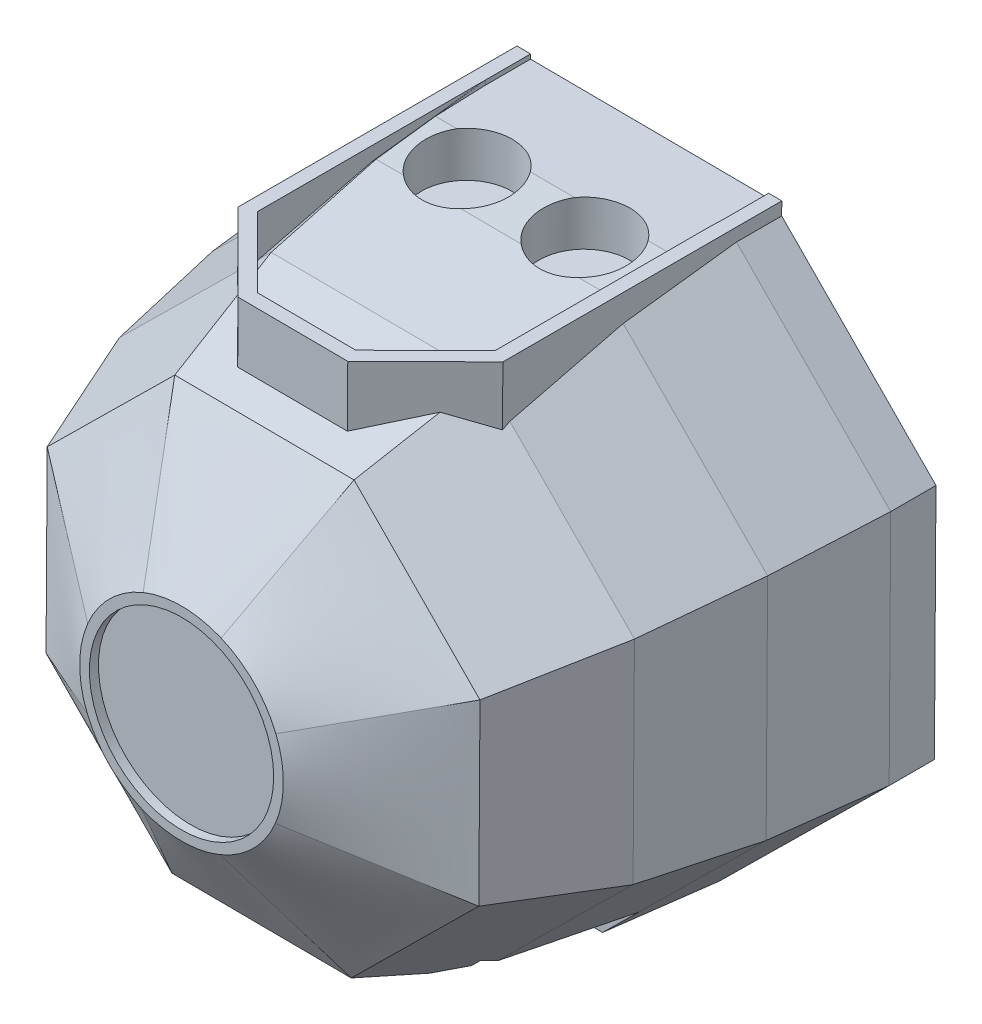
from build123d import *

# Parameters (mm, degrees)
RESSALTO_EXTRUS_O1_DEPTH  = 10
RESSALTO_EXTRUS_O2_DEPTH  = 25
RESSALTO_EXTRUS_O2_TAPER  = 5
RESSALTO_EXTRUS_O3_DEPTH  = 25
RESSALTO_EXTRUS_O3_TAPER  = 10
RESSALTO_EXTRUS_O4_DEPTH  = 25
RESSALTO_EXTRUS_O4_TAPER  = 20
ESBO_O8_R                 = 5
RESSALTO_EXTRUS_O6_DEPTH  = 18
CORTE_EXTRUS_O2_DEPTH     = 2
RESSALTO_EXTRUS_O10_DEPTH = 50
CORTE_EXTRUS_O5_START     = 35
CORTE_EXTRUS_O5_DEPTH     = 50
CORTE_EXTRUS_O6_DEPTH     = 20
CORTE_EXTRUS_O7_DEPTH     = 1
ESBO_O17_R                = 10
CORTE_EXTRUS_O8_DEPTH     = 10


with BuildPart() as part:
    # Esboço1 → Ressalto-extrusão1 (new body)
    with BuildSketch(Plane.XY):
        Polygon((11.714282715, 142.58825066), (-25.240942572, 180.026335933), (-77.844956945, 180.367769505), (-115.283042218, 143.412544218), (-115.624475789, 90.808529845), (-78.669250503, 53.370444572), (-26.06523613, 53.029011), (11.372849143, 89.984236287), align=None)
    extrude(amount=RESSALTO_EXTRUS_O1_DEPTH)

    # Esboço3 → Ressalto-extrusão2 (add)
    with BuildSketch(Plane.XY.offset(10)):
        Polygon((11.372849143, 89.984236287), (11.714282715, 142.58825066), (-25.240942572, 180.026335933), (-77.844956945, 180.367769505), (-115.283042218, 143.412544218), (-115.624475789, 90.808529845), (-78.669250503, 53.370444572), (-26.06523613, 53.029011), align=None)
    extrude(amount=RESSALTO_EXTRUS_O2_DEPTH, taper=RESSALTO_EXTRUS_O2_TAPER)

    # Esboço4 → Ressalto-extrusão3 (add)
    with BuildSketch(Plane.XY.offset(35)):
        Polygon((-26.956995692, 55.222061748), (9.191558856, 90.904388109), (9.521231967, 141.696491098), (-26.161094394, 177.845045645), (-76.953197383, 178.174718757), (-113.10175193, 142.492392396), (-113.431425042, 91.700289407), (-77.749098681, 55.55173486), align=None)
    extrude(amount=RESSALTO_EXTRUS_O3_DEPTH, taper=RESSALTO_EXTRUS_O3_TAPER)

    # Esboço5 → Ressalto-extrusão4 (add)
    with BuildSketch(Plane.XY.offset(60)):
        Polygon((-75.894600212, 59.947965354), (-28.754271643, 59.641994585), (4.795328361, 92.758886578), (5.10129913, 139.899215147), (-28.015592863, 173.448815151), (-75.155921432, 173.75478592), (-108.705521436, 140.637893927), (-109.011492205, 93.497565358), align=None)
    extrude(amount=RESSALTO_EXTRUS_O4_DEPTH, taper=RESSALTO_EXTRUS_O4_TAPER)

    # Esboço8 → Ressalto-extrusão6 (add)
    with BuildSketch(Plane.XY.offset(85)):
        with Locations((-51.955096537, 116.698390253)):
            Circle(ESBO_O8_R)
    extrude(amount=RESSALTO_EXTRUS_O6_DEPTH)

    # Esboço6 → Loft1 section 0
    with BuildSketch(Plane.XY.offset(85)):
        with BuildLine():
            Line((-99.887965086, 97.207462428), (-72.066585693, 69.022566624))
            Line((-72.066585693, 69.022566624), (-32.464168713, 68.765521704))
            Line((-32.464168713, 68.765521704), (-4.279272909, 96.586901097))
            Line((-4.279272909, 96.586901097), (-4.022227989, 136.189318077))
            Line((-4.022227989, 136.189318077), (-31.843607381, 164.374213881))
            Line((-31.843607381, 164.374213881), (-71.446024362, 164.631258801))
            Line((-71.446024362, 164.631258801), (-99.630920166, 136.809879409))
            Line((-99.630920166, 136.809879409), (-99.887965086, 97.207462428))
        make_face()
    # Esboço7 for Loft1 → Loft1 section 1
    with BuildSketch(Plane.XY.offset(103)):
        with BuildLine():
            # circular arc as an exact rational Bezier (weights 1, cos(half-angle), 1)
            Bezier((-72.797833823, 108.223114301), (-69.28725958, 99.58976984), (-60.700212313, 95.967424282), weights=[1, 0.923879532, 1])
            Bezier((-60.700212313, 95.967424282), (-52.113165047, 92.345078724), (-43.479820586, 95.855652967), weights=[1, 0.923879533, 1])
            Bezier((-43.479820586, 95.855652967), (-34.846476125, 99.36622721), (-31.224130567, 107.953274477), weights=[1, 0.923879532, 1])
            Bezier((-31.224130567, 107.953274477), (-27.601785009, 116.540321743), (-31.112359252, 125.173666204), weights=[1, 0.923879533, 1])
            Bezier((-31.112359252, 125.173666204), (-34.622933495, 133.807010665), (-43.209980762, 137.429356223), weights=[1, 0.923879532, 1])
            Bezier((-43.209980762, 137.429356223), (-51.797028028, 141.051701781), (-60.430372489, 137.541127538), weights=[1, 0.923879533, 1])
            Bezier((-60.430372489, 137.541127538), (-69.06371695, 134.030553295), (-72.686062508, 125.443506028), weights=[1, 0.923879532, 1])
            Bezier((-72.686062508, 125.443506028), (-76.308408066, 116.856458762), (-72.797833823, 108.223114301), weights=[1, 0.923879533, 1])
        make_face()
    loft()

    # Esboço9 → Corte-extrusão2 (cut)
    with BuildSketch(Plane.XY.offset(103)):
        with BuildLine():
            ThreePointArc((-44.042402012, 135.456037969), (-51.822961029, 137.056254156), (-59.62363648, 135.557170109))
            ThreePointArc((-59.62363648, 135.557170109), (-66.25684624, 131.187007783), (-70.712744254, 124.611084778))
            ThreePointArc((-70.712744254, 124.611084778), (-72.312960441, 116.830525761), (-70.813876394, 109.02985031))
            ThreePointArc((-70.813876394, 109.02985031), (-66.443714068, 102.39664055), (-59.867791063, 97.940742536))
            ThreePointArc((-59.867791063, 97.940742536), (-52.087232046, 96.340526349), (-44.286556595, 97.839610396))
            ThreePointArc((-44.286556595, 97.839610396), (-37.653346835, 102.209772722), (-33.197448821, 108.785695727))
            ThreePointArc((-33.197448821, 108.785695727), (-31.597232634, 116.566254744), (-33.096316681, 124.366930195))
            ThreePointArc((-33.096316681, 124.366930195), (-37.466479007, 131.000139955), (-44.042402012, 135.456037969))
        make_face()
    extrude(amount=-CORTE_EXTRUS_O2_DEPTH, mode=Mode.SUBTRACT)

    # Esboço13 → Corte-extrusão5 (cut)
    with BuildSketch(Plane.XY.offset(CORTE_EXTRUS_O5_START)):
        Polygon((-98.070713952, 55.683635091), (-5.651465, 55.083775278), (-7.425428207, 63.095457942), (-96.192902738, 63.671615412), align=None)
    extrude(amount=CORTE_EXTRUS_O5_DEPTH, mode=Mode.SUBTRACT)

    # Esboço15 → Corte-extrusão6 (cut)
    with BuildSketch(Plane(origin=(0.409199665, 63.044606215, 0), x_dir=(0.9999789364800716, -0.006490500457210974, 0), z_dir=(-0.006490500457210974, -0.9999789364800716, 0))):
        Polygon((-79.311433136, 61.3), (-60.111433136, 61.3), (-60.111433136, 63.8), (-25.511433136, 63.8), (-25.511433136, 46), (-79.311433136, 46), align=None)
    extrude(amount=-CORTE_EXTRUS_O6_DEPTH, mode=Mode.SUBTRACT)


with BuildPart() as body_2:
    # Esboço12 → Ressalto-extrusão10 (new body)
    with BuildSketch(Plane(origin=(1.167373089, 179.854929138, 0), x_dir=(0.9999789364800716, -0.0064905004572113805, 0), z_dir=(0.0064905004572113805, 0.9999789364800716, 0))):
        Polygon((-79.013994346, 0), (-82.013994346, 0), (-82.013994346, -61.615746699), (-64.879741046, -78.75), (-40.648247647, -78.75), (-23.513994346, -61.615746699), (-23.513994346, 0), (-26.408871925, 0), (-26.408871925, -10), (-26.513994346, -10), (-26.513994346, -60.373106012), (-41.890888334, -75.75), (-63.637100359, -75.75), (-79.013994346, -60.373106012), (-79.013994346, -10), align=None)
    extrude(amount=-RESSALTO_EXTRUS_O10_DEPTH)


with BuildPart() as corte_extrus_o7_tool:
    # Esboço16 → Corte-extrusão7 (new body)
    with BuildSketch(Plane(origin=(1.167373089, 179.854929138, 0), x_dir=(0.9999789364800716, -0.0064905004572113805, 0), z_dir=(0.0064905004572113805, 0.9999789364800716, 0))):
        Polygon((-26.408871925, 0), (-79.013994346, 0), (-79.013994346, -10), (-78.108019572, -35), (-27.314846699, -35), (-26.408871925, -10), align=None)
    extrude(amount=-CORTE_EXTRUS_O7_DEPTH)


with BuildPart() as part_1:
    add(part.part)

    # Corte-extrusão7: cut by corte_extrus_o7_tool
    add(corte_extrus_o7_tool.part, mode=Mode.SUBTRACT)

    # Esboço17 → Corte-extrusão8 (cut)
    with BuildSketch(Plane(origin=(1.160882588, 178.854950202, 0), x_dir=(0.9999789364800716, -0.0064905004572113805, 0), z_dir=(0.0064905004572113805, 0.9999789364800716, 0))):
        with Locations(Location((-39.763994346, -27.25, 0), (0, 0, 180))):
            Circle(ESBO_O17_R)
        with Locations(Location((-65.763994346, -27.25, 0), (0, 0, 180))):
            Circle(ESBO_O17_R)
    extrude(amount=-CORTE_EXTRUS_O8_DEPTH, mode=Mode.SUBTRACT)


with BuildPart() as body_2_1:
    add(body_2.part)

    # Corte-extrusão7: cut by corte_extrus_o7_tool
    add(corte_extrus_o7_tool.part, mode=Mode.SUBTRACT)


with BuildPart() as part_2:
    add(part_1.part)

    # Combinar1: union body 2
    add(body_2_1.part)


solid = part_2.part
